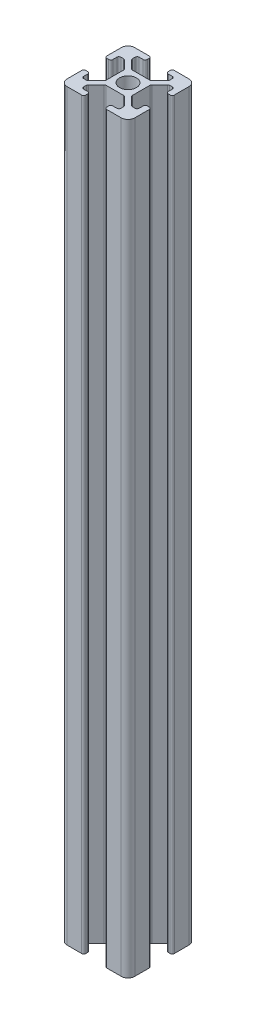
from build123d import *

# Parameters (mm, degrees)
SKETCH_1_R      = 2.5
EXTRUDE_1_DEPTH = 220


with BuildPart() as part:
    # 草图1 → 凸台-拉伸1 (new body)
    with BuildSketch(Plane(origin=(0, 0, 0), x_dir=(1, 0, 0), z_dir=(0, 1, 0))):
        with BuildLine():
            Line((3.1, 8.8), (3.1, 9.4))
            ThreePointArc((3.1, 9.4), (3.275735931, 9.824264069), (3.7, 10))
            Line((3.7, 10), (8, 10))
            ThreePointArc((8, 10), (9.414213562, 9.414213562), (10, 8))
            Line((10, 8), (10, 3.7))
            ThreePointArc((10, 3.7), (9.824264069, 3.275735931), (9.4, 3.1))
            Line((9.4, 3.1), (8.8, 3.1))
            ThreePointArc((8.8, 3.1), (8.375735931, 3.275735931), (8.2, 3.7))
            Line((8.2, 3.7), (8.2, 4.9))
            ThreePointArc((8.2, 4.9), (8.024264069, 5.324264069), (7.6, 5.5))
            Line((7.6, 5.5), (6.809188309, 5.5))
            ThreePointArc((6.809188309, 5.5), (6.57957825, 5.45432772), (6.38492424, 5.324264069))
            Line((6.38492424, 5.324264069), (4.075735931, 3.01507576))
            ThreePointArc((4.075735931, 3.01507576), (3.94567228, 2.82042175), (3.9, 2.590811691))
            Line((3.9, 2.590811691), (3.9, 0))
            Line((3.9, 0), (3.9, -2.590811691))
            ThreePointArc((3.9, -2.590811691), (3.94567228, -2.82042175), (4.075735931, -3.01507576))
            Line((4.075735931, -3.01507576), (6.38492424, -5.324264069))
            ThreePointArc((6.38492424, -5.324264069), (6.57957825, -5.45432772), (6.809188309, -5.5))
            Line((6.809188309, -5.5), (7.6, -5.5))
            ThreePointArc((7.6, -5.5), (8.024264069, -5.324264069), (8.2, -4.9))
            Line((8.2, -4.9), (8.2, -3.7))
            ThreePointArc((8.2, -3.7), (8.375735931, -3.275735931), (8.8, -3.1))
            Line((8.8, -3.1), (9.4, -3.1))
            ThreePointArc((9.4, -3.1), (9.824264069, -3.275735931), (10, -3.7))
            Line((10, -3.7), (10, -8))
            ThreePointArc((10, -8), (9.414213562, -9.414213562), (8, -10))
            Line((8, -10), (3.7, -10))
            ThreePointArc((3.7, -10), (3.275735931, -9.824264069), (3.1, -9.4))
            Line((3.1, -9.4), (3.1, -8.8))
            ThreePointArc((3.1, -8.8), (3.275735931, -8.375735931), (3.7, -8.2))
            Line((3.7, -8.2), (4.9, -8.2))
            ThreePointArc((4.9, -8.2), (5.324264069, -8.024264069), (5.5, -7.6))
            Line((5.5, -7.6), (5.5, -6.809188309))
            ThreePointArc((5.5, -6.809188309), (5.45432772, -6.57957825), (5.324264069, -6.38492424))
            Line((5.324264069, -6.38492424), (3.01507576, -4.075735931))
            ThreePointArc((3.01507576, -4.075735931), (2.82042175, -3.94567228), (2.590811691, -3.9))
            Line((2.590811691, -3.9), (0, -3.9))
            Line((0, -3.9), (-2.590811691, -3.9))
            ThreePointArc((-2.590811691, -3.9), (-2.82042175, -3.94567228), (-3.01507576, -4.075735931))
            Line((-3.01507576, -4.075735931), (-5.324264069, -6.38492424))
            ThreePointArc((-5.324264069, -6.38492424), (-5.45432772, -6.57957825), (-5.5, -6.809188309))
            Line((-5.5, -6.809188309), (-5.5, -7.6))
            ThreePointArc((-5.5, -7.6), (-5.324264069, -8.024264069), (-4.9, -8.2))
            Line((-4.9, -8.2), (-3.7, -8.2))
            ThreePointArc((-3.7, -8.2), (-3.275735931, -8.375735931), (-3.1, -8.8))
            Line((-3.1, -8.8), (-3.1, -9.4))
            ThreePointArc((-3.1, -9.4), (-3.275735931, -9.824264069), (-3.7, -10))
            Line((-3.7, -10), (-8, -10))
            ThreePointArc((-8, -10), (-9.414213562, -9.414213562), (-10, -8))
            Line((-10, -8), (-10, -3.7))
            ThreePointArc((-10, -3.7), (-9.824264069, -3.275735931), (-9.4, -3.1))
            Line((-9.4, -3.1), (-8.8, -3.1))
            ThreePointArc((-8.8, -3.1), (-8.375735931, -3.275735931), (-8.2, -3.7))
            Line((-8.2, -3.7), (-8.2, -4.9))
            ThreePointArc((-8.2, -4.9), (-8.024264069, -5.324264069), (-7.6, -5.5))
            Line((-7.6, -5.5), (-6.809188309, -5.5))
            ThreePointArc((-6.809188309, -5.5), (-6.57957825, -5.45432772), (-6.38492424, -5.324264069))
            Line((-6.38492424, -5.324264069), (-4.075735931, -3.01507576))
            ThreePointArc((-4.075735931, -3.01507576), (-3.94567228, -2.82042175), (-3.9, -2.590811691))
            Line((-3.9, -2.590811691), (-3.9, 0))
            Line((-3.9, 0), (-3.9, 2.590811691))
            ThreePointArc((-3.9, 2.590811691), (-3.94567228, 2.82042175), (-4.075735931, 3.01507576))
            Line((-4.075735931, 3.01507576), (-6.38492424, 5.324264069))
            ThreePointArc((-6.38492424, 5.324264069), (-6.57957825, 5.45432772), (-6.809188309, 5.5))
            Line((-6.809188309, 5.5), (-7.6, 5.5))
            ThreePointArc((-7.6, 5.5), (-8.024264069, 5.324264069), (-8.2, 4.9))
            Line((-8.2, 4.9), (-8.2, 3.7))
            ThreePointArc((-8.2, 3.7), (-8.375735931, 3.275735931), (-8.8, 3.1))
            Line((-8.8, 3.1), (-9.4, 3.1))
            ThreePointArc((-9.4, 3.1), (-9.824264069, 3.275735931), (-10, 3.7))
            Line((-10, 3.7), (-10, 8))
            ThreePointArc((-10, 8), (-9.414213562, 9.414213562), (-8, 10))
            Line((-8, 10), (-3.7, 10))
            ThreePointArc((-3.7, 10), (-3.275735931, 9.824264069), (-3.1, 9.4))
            Line((-3.1, 9.4), (-3.1, 8.8))
            ThreePointArc((-3.1, 8.8), (-3.275735931, 8.375735931), (-3.7, 8.2))
            Line((-3.7, 8.2), (-4.9, 8.2))
            ThreePointArc((-4.9, 8.2), (-5.324264069, 8.024264069), (-5.5, 7.6))
            Line((-5.5, 7.6), (-5.5, 6.809188309))
            ThreePointArc((-5.5, 6.809188309), (-5.45432772, 6.57957825), (-5.324264069, 6.38492424))
            Line((-5.324264069, 6.38492424), (-3.01507576, 4.075735931))
            ThreePointArc((-3.01507576, 4.075735931), (-2.82042175, 3.94567228), (-2.590811691, 3.9))
            Line((-2.590811691, 3.9), (0, 3.9))
            Line((0, 3.9), (2.590811691, 3.9))
            ThreePointArc((2.590811691, 3.9), (2.82042175, 3.94567228), (3.01507576, 4.075735931))
            Line((3.01507576, 4.075735931), (5.324264069, 6.38492424))
            ThreePointArc((5.324264069, 6.38492424), (5.45432772, 6.57957825), (5.5, 6.809188309))
            Line((5.5, 6.809188309), (5.5, 7.6))
            ThreePointArc((5.5, 7.6), (5.324264069, 8.024264069), (4.9, 8.2))
            Line((4.9, 8.2), (3.7, 8.2))
            ThreePointArc((3.7, 8.2), (3.275735931, 8.375735931), (3.1, 8.8))
        make_face()
        with Locations(Location((0, 0, 0), (0, 0, 270))):
            Circle(SKETCH_1_R, mode=Mode.SUBTRACT)
    extrude(amount=EXTRUDE_1_DEPTH)


solid = part.part
